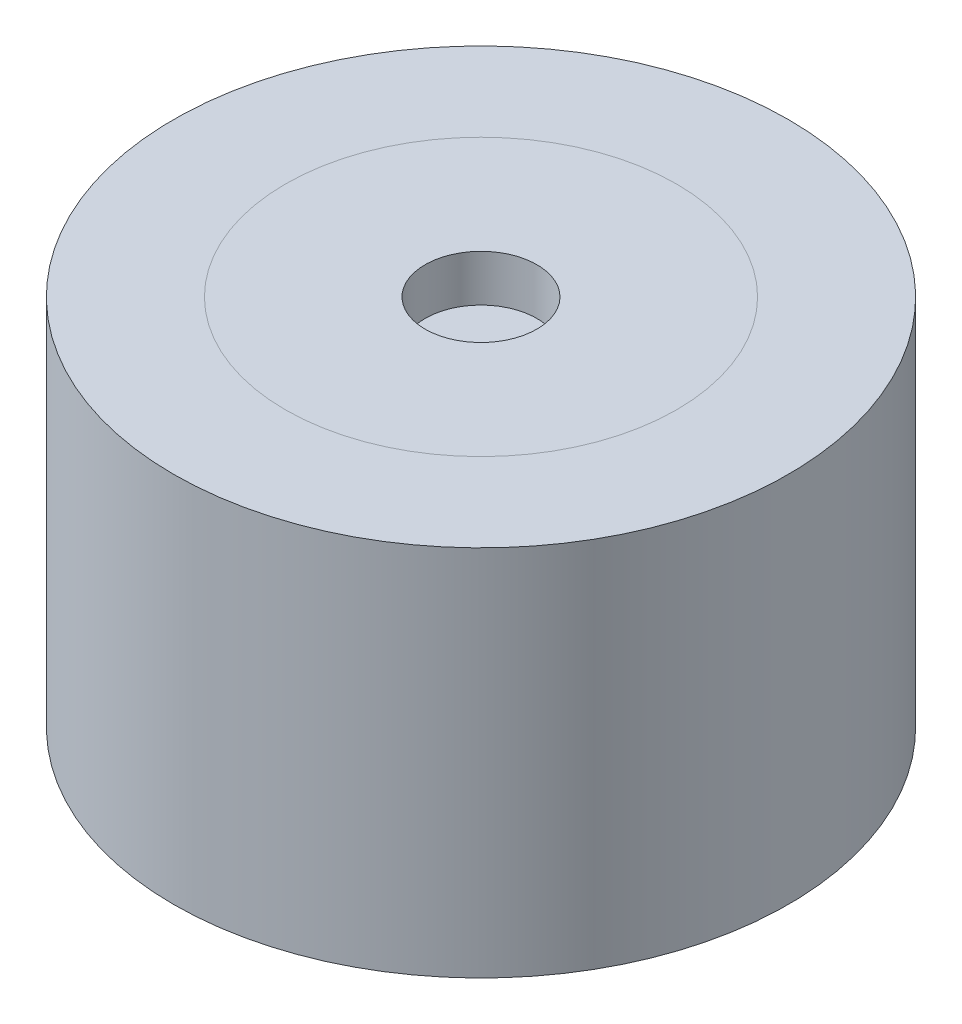
from build123d import *

# Parameters (mm, degrees)
SKETCH_1_R                     = 33
EXTRUDE_1_DEPTH                = 40
SKETCH_2_R                     = 6
CUT_EXTRUDE_1_DEPTH            = 5
SPLIT_BODIES_1_SURFACE_1_BACK  = 102.548
SPLIT_BODIES_1_SURFACE_1_DEPTH = 205.096
SPLIT_BODIES_1_SURFACE_2_BACK  = 102.548
SPLIT_BODIES_1_SURFACE_2_DEPTH = 205.096


with BuildPart() as part:
    # 草图1 → 凸台-拉伸1 (new body)
    with BuildSketch(Plane(origin=(0, 0, 0), x_dir=(1, 0, 0), z_dir=(0, 1, 0))):
        with Locations(Location((0, 0, 0), (0, 0, 270))):
            Circle(SKETCH_1_R)
    extrude(amount=EXTRUDE_1_DEPTH)

    # 草图2 → 切除-拉伸1 (cut)
    with BuildSketch(Plane(origin=(0, 40, 0), x_dir=(1, 0, 0), z_dir=(0, 1, 0))):
        with Locations(Location((0, 0, 0), (0, 0, 270))):
            Circle(SKETCH_2_R)
    extrude(amount=-CUT_EXTRUDE_1_DEPTH, mode=Mode.SUBTRACT)


with BuildPart() as body_2:
    # Split Bodies 1: the piece behind the surface
    add(part.part)
    # Split Bodies 1 surface: a surface, the sketch's curves swept straight by 205.096 mm
    with BuildLine(Plane.XZ.offset(-SPLIT_BODIES_1_SURFACE_1_BACK), mode=Mode.PRIVATE) as split_bodies_1_surface_1_path:
        CenterArc((0, 0), 21, 0, 360)
    split_bodies_1_surface_1 = Shell.extrude(split_bodies_1_surface_1_path.wire(), (0 * SPLIT_BODIES_1_SURFACE_1_DEPTH, -1 * SPLIT_BODIES_1_SURFACE_1_DEPTH, 0 * SPLIT_BODIES_1_SURFACE_1_DEPTH))
    split(bisect_by=split_bodies_1_surface_1, keep=Keep.BOTTOM)


with BuildPart() as part_1:
    add(part.part)

    # Split Bodies 1: split by a surface, the side it looks to stays
    # Split Bodies 1 surface: a surface, the sketch's curves swept straight by 205.096 mm
    with BuildLine(Plane.XZ.offset(-SPLIT_BODIES_1_SURFACE_2_BACK), mode=Mode.PRIVATE) as split_bodies_1_surface_2_path:
        CenterArc((0, 0), 21, 0, 360)
    split_bodies_1_surface_2 = Shell.extrude(split_bodies_1_surface_2_path.wire(), (0 * SPLIT_BODIES_1_SURFACE_2_DEPTH, -1 * SPLIT_BODIES_1_SURFACE_2_DEPTH, 0 * SPLIT_BODIES_1_SURFACE_2_DEPTH))
    split(bisect_by=split_bodies_1_surface_2, keep=Keep.TOP)


solid = Compound([body_2.part, part_1.part])
